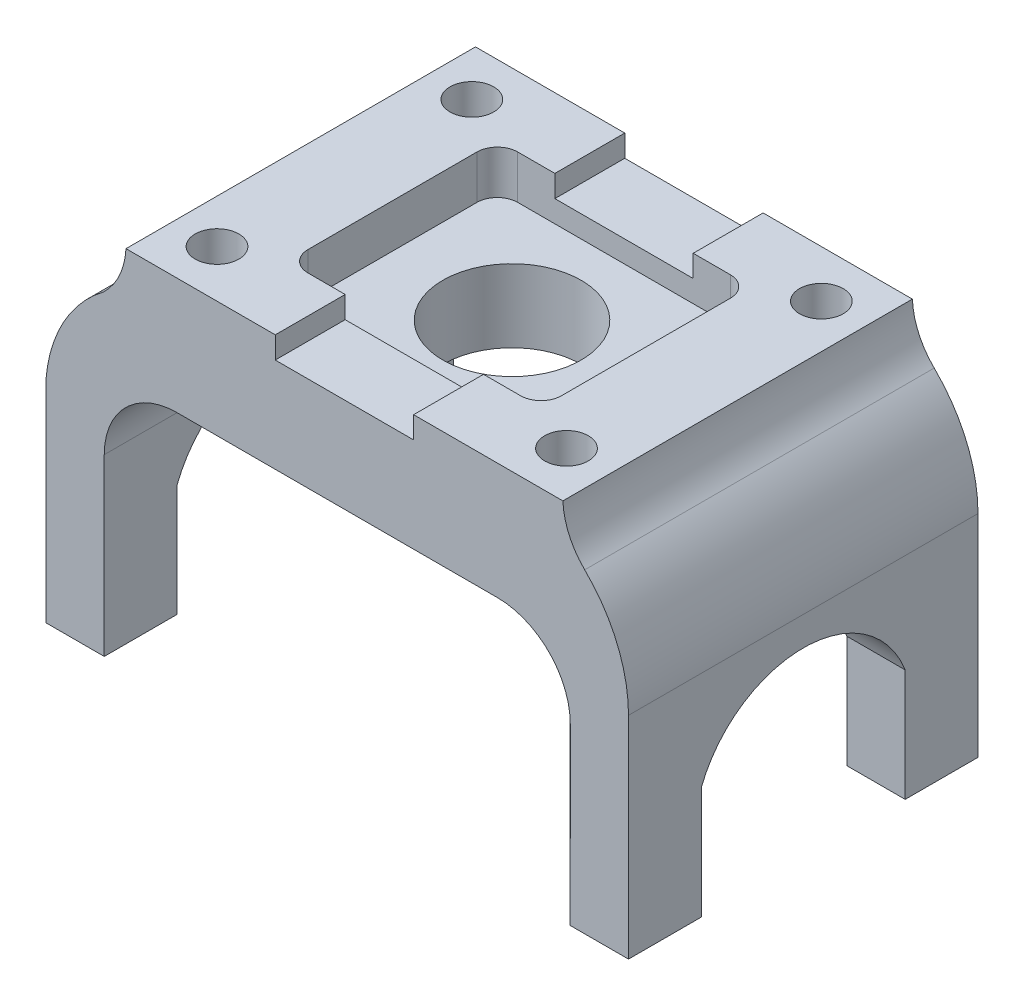
from build123d import *

# Parameters (mm, degrees)
BOSS_EXTRUDE1_DEPTH = 60.96
CUT_EXTRUDE1_DEPTH  = 101.6
CUT_EXTRUDE2_DEPTH  = 7.62
SKETCH6_R           = 12.065
CUT_EXTRUDE3_DEPTH  = 12.7
SKETCH7_R           = 3.81
CUT_EXTRUDE5_DEPTH  = 102.631745151


with BuildPart() as part:
    # Sketch3 → Boss-Extrude1 (new body)
    with BuildSketch(Plane.XY):
        with BuildLine():
            Line((-27.94, 0.030892605), (27.94, 0.030892605))
            ThreePointArc((27.94, 0.030892605), (36.920256121, -3.688851274), (40.64, -12.669107395))
            Line((40.64, -12.669107395), (40.64, -43.149107395))
            Line((40.64, -43.149107395), (50.8, -43.149107395))
            Line((50.8, -43.149107395), (50.8, -6.319107395))
            ThreePointArc((50.8, -6.319107395), (48.812332806, 3.530901366), (43.160419482, 11.83929286))
            ThreePointArc((43.160419482, 11.83929286), (40.447471444, 15.733062174), (39.353319429, 20.350892605))
            Line((39.353319429, 20.350892605), (13.318319429, 20.350892605))
            Line((13.318319429, 20.350892605), (13.318319429, 16.540892605))
            Line((13.318319429, 16.540892605), (-10.811680571, 16.540892605))
            Line((-10.811680571, 16.540892605), (-10.811680571, 20.350892605))
            Line((-10.811680571, 20.350892605), (-36.846680571, 20.350892605))
            ThreePointArc((-36.846680571, 20.350892605), (-37.999423394, 15.718716246), (-40.780780624, 11.83929286))
            ThreePointArc((-40.780780624, 11.83929286), (-47.728103025, 3.829260087), (-50.8, -6.319107395))
            Line((-50.8, -6.319107395), (-50.8, -43.149107395))
            Line((-50.8, -43.149107395), (-40.64, -43.149107395))
            Line((-40.64, -43.149107395), (-40.64, -12.669107395))
            ThreePointArc((-40.64, -12.669107395), (-36.920256121, -3.688851274), (-27.94, 0.030892605))
        make_face()
    extrude(amount=-BOSS_EXTRUDE1_DEPTH)

    # Sketch4 → Cut-Extrude1 (cut)
    with BuildSketch(Plane(origin=(50.8, 0, 0), x_dir=(0, 0, -1), z_dir=(1, 0, 0))):
        with BuildLine():
            Line((12.7, -43.149107395), (12.7, -23.591107395))
            ThreePointArc((12.7, -23.591107395), (30.48, -11.3802667), (48.26, -23.591107395))
            Line((48.26, -23.591107395), (48.26, -43.149107395))
            Line((48.26, -43.149107395), (12.7, -43.149107395))
        make_face()
    extrude(amount=-CUT_EXTRUDE1_DEPTH, mode=Mode.SUBTRACT)

    # Sketch5 → Cut-Extrude2 (cut)
    with BuildSketch(Plane(origin=(0, 20.350892605, 0), x_dir=(1, 0, 0), z_dir=(0, 1, 0))):
        with BuildLine():
            Line((-20.844680571, 45.212), (-20.844680571, 15.748))
            ThreePointArc((-20.844680571, 15.748), (-19.803152285, 13.233528286), (-17.288680571, 12.192))
            Line((-17.288680571, 12.192), (19.795319429, 12.192))
            ThreePointArc((19.795319429, 12.192), (22.309791143, 13.233528286), (23.351319429, 15.748))
            Line((23.351319429, 15.748), (23.351319429, 45.212))
            ThreePointArc((23.351319429, 45.212), (22.309791143, 47.726471714), (19.795319429, 48.768))
            Line((19.795319429, 48.768), (-17.288680571, 48.768))
            ThreePointArc((-17.288680571, 48.768), (-19.803152285, 47.726471714), (-20.844680571, 45.212))
        make_face()
    extrude(amount=-CUT_EXTRUDE2_DEPTH, mode=Mode.SUBTRACT)

    # Sketch6 → Cut-Extrude3 (cut)
    with BuildSketch(Plane(origin=(0, 12.730892605, 0), x_dir=(1, 0, 0), z_dir=(0, 1, 0))):
        with Locations(Location((0, 30.48, 0), (0, 0, 180))):
            Circle(SKETCH6_R)
    extrude(amount=-CUT_EXTRUDE3_DEPTH, mode=Mode.SUBTRACT)

    # Sketch7 → Cut-Extrude5 (cut, through all)
    with BuildSketch(Plane(origin=(0, 20.350892605, 0), x_dir=(1, 0, 0), z_dir=(0, 1, 0))):
        with Locations(Location((-29.226680571, 52.705, 0), (0, 0, 180))):
            Circle(SKETCH7_R)
        with Locations(Location((31.733319429, 52.705, 0), (0, 0, 180))):
            Circle(SKETCH7_R)
        with Locations(Location((31.733319429, 8.255, 0), (0, 0, 180))):
            Circle(SKETCH7_R)
        with Locations(Location((-29.226680571, 8.255, 0), (0, 0, 180))):
            Circle(SKETCH7_R)
    extrude(amount=-CUT_EXTRUDE5_DEPTH, mode=Mode.SUBTRACT)


solid = part.part
